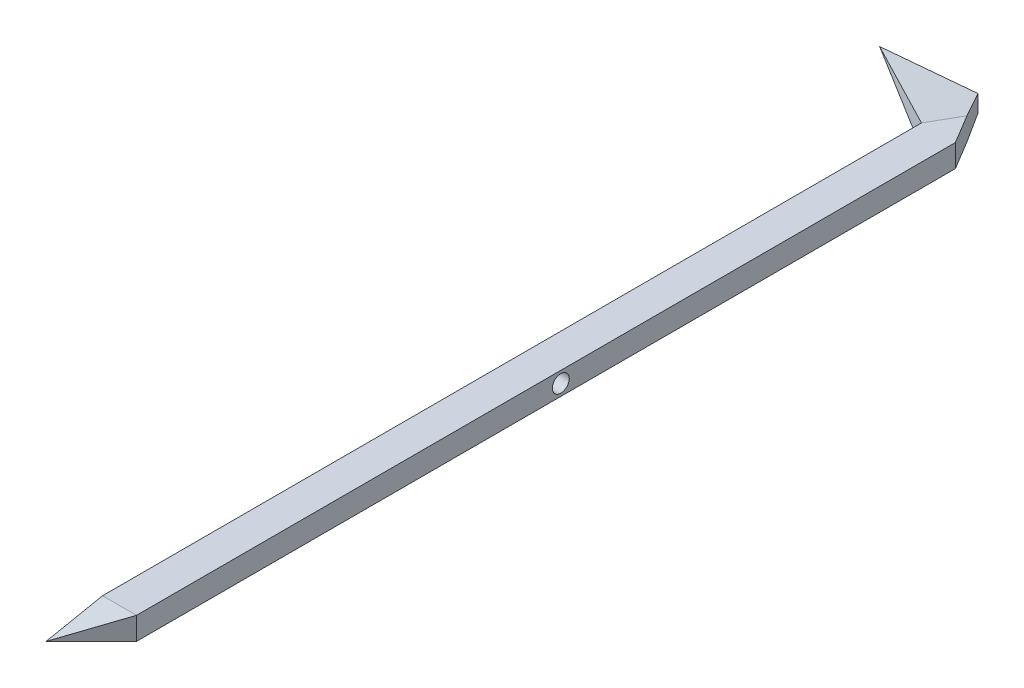
from build123d import *

# Parameters (mm, degrees)
BOSS_EXTRUDE1_DEPTH     = 5.08
CUT_EXTRUDE1_DEPTH      = 109.941018249
CUT_EXTRUDE1_DEPTH_BACK = 109.941018249
CUT_EXTRUDE2_DEPTH      = 185.574421805
CUT_EXTRUDE2_DEPTH_BACK = 185.574421805
SKETCH4_R               = 1.905
CUT_EXTRUDE3_DEPTH      = 21.336


with BuildPart() as part:
    # Sketch1 → Boss-Extrude1 (new body)
    with BuildSketch(Plane(origin=(0, 0, 0), x_dir=(1, 0, 0), z_dir=(0, 1, 0))):
        Polygon((7.62, -91.9861), (7.62, 91.9861), (0, 104.6861), (0, -104.6861), align=None)
        Polygon((0, 91.9861), (0, 104.6861), (-22.098, 104.6861), align=None)
    extrude(amount=BOSS_EXTRUDE1_DEPTH)

    # Sketch2 → Cut-Extrude1 (cut, two sides: drawn at the far end of the back side and taken through both)
    with BuildSketch(Plane(origin=(7.62, 0, 0), x_dir=(0, 0, -1), z_dir=(1, 0, 0)).offset(-CUT_EXTRUDE1_DEPTH_BACK)):
        Polygon((-104.6861, 5.08), (-91.9861, 5.08), (-104.6861, 2.54), align=None)
        Polygon((-104.6861, 0), (-104.6861, 2.54), (-91.9861, 0), align=None)
    extrude(amount=CUT_EXTRUDE1_DEPTH + CUT_EXTRUDE1_DEPTH_BACK, mode=Mode.SUBTRACT)

    # Sketch3 → Cut-Extrude2 (cut, two sides: drawn at the far end of the back side and taken through both)
    with BuildSketch(Plane(origin=(39.73974923, 0, -69.147163661), x_dir=(0.867013943985018, 0, 0.4982838758534578), z_dir=(-0.4982838758534578, 0, 0.867013943985018)).offset(-CUT_EXTRUDE2_DEPTH_BACK)):
        Polygon((-71.32266979, 2.54), (-45.835190433, 5.08), (-71.32266979, 5.08), align=None)
        Polygon((-45.835190433, 0), (-71.32266979, 2.54), (-71.32266979, 0), align=None)
    extrude(amount=CUT_EXTRUDE2_DEPTH + CUT_EXTRUDE2_DEPTH_BACK, mode=Mode.SUBTRACT)

    # Sketch4 → Cut-Extrude3 (cut)
    with BuildSketch(Plane.ZY):
        with Locations((-3.3401, 2.54)):
            Circle(SKETCH4_R)
    extrude(amount=-CUT_EXTRUDE3_DEPTH, mode=Mode.SUBTRACT)


solid = part.part
